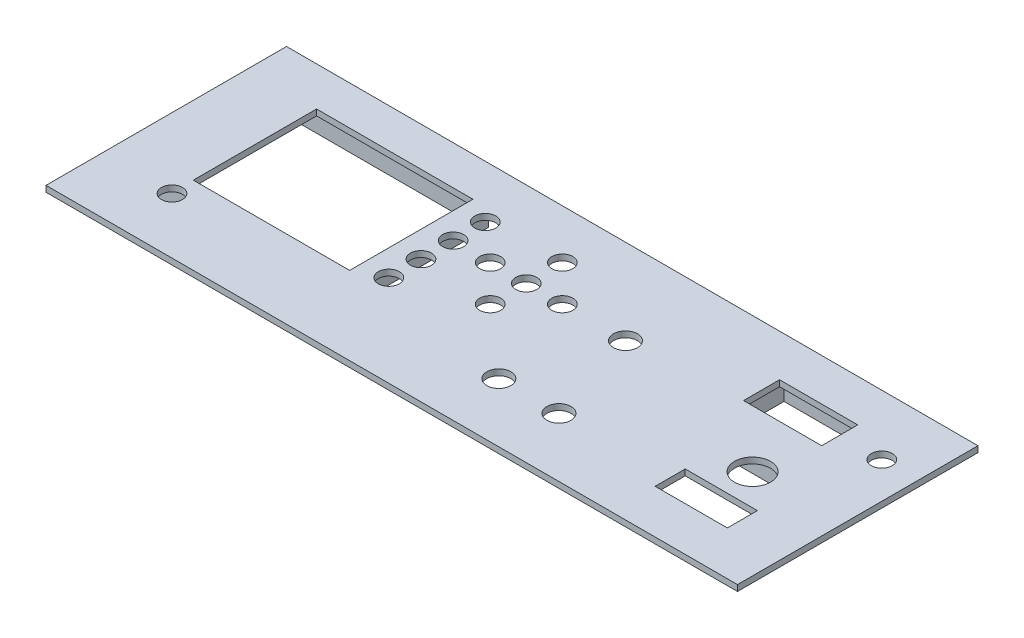
from build123d import *

# Parameters (mm, degrees)
SKETCH_1_W      = 230
SKETCH_1_H      = 80
SKETCH_1_R      = 3.5
SKETCH_1_R_2    = 4
SKETCH_1_R_3    = 6
SKETCH_1_W_2    = 52
SKETCH_1_H_2    = 41
SKETCH_1_W_3    = 26
SKETCH_1_H_3    = 12
SKETCH_1_W_4    = 24
SKETCH_1_H_4    = 10
EXTRUDE_1_DEPTH = 2
SKETCH_3_W      = 66.2
SKETCH_3_H      = 46.5
SKETCH_3_W_2    = 63.2
SKETCH_3_H_2    = 43.5
SKETCH_3_W_3    = 31
SKETCH_3_H_3    = 27.5
SKETCH_3_W_4    = 28
SKETCH_3_H_4    = 24.5
EXTRUDE_2_DEPTH = 6


with BuildPart() as part:
    # 草图1 → 凸台-拉伸1 (new body)
    with BuildSketch(Plane(origin=(0, 0, 0), x_dir=(1, 0, 0), z_dir=(0, 1, 0))):
        with Locations((23.568232821, 7.271766922)):
            Rectangle(SKETCH_1_W, SKETCH_1_H)
        with Locations(Location((-68.131767179, -14.128233078, 0), (0, 0, 270))):
            Circle(SKETCH_1_R, mode=Mode.SUBTRACT)
        with Locations(Location((-7.811767179, 29.771766922, 0), (0, 0, 270))):
            Circle(SKETCH_1_R, mode=Mode.SUBTRACT)
        with Locations(Location((-7.811767179, 19.071766922, 0), (0, 0, 270))):
            Circle(SKETCH_1_R, mode=Mode.SUBTRACT)
        with Locations(Location((-7.811767179, 8.371766922, 0), (0, 0, 270))):
            Circle(SKETCH_1_R, mode=Mode.SUBTRACT)
        with Locations(Location((-7.811767179, -2.328233078, 0), (0, 0, 270))):
            Circle(SKETCH_1_R, mode=Mode.SUBTRACT)
        with Locations(Location((16.688232821, 30.896203348, 0), (0, 0, 270))):
            Circle(SKETCH_1_R, mode=Mode.SUBTRACT)
        with Locations(Location((16.688232821, 18.896203348, 0), (0, 0, 270))):
            Circle(SKETCH_1_R, mode=Mode.SUBTRACT)
        with Locations(Location((16.688232821, 6.896203348, 0), (0, 0, 270))):
            Circle(SKETCH_1_R, mode=Mode.SUBTRACT)
        with Locations(Location((4.688232821, 18.896203348, 0), (0, 0, 270))):
            Circle(SKETCH_1_R, mode=Mode.SUBTRACT)
        with Locations(Location((28.688232821, 18.896203348, 0), (0, 0, 270))):
            Circle(SKETCH_1_R, mode=Mode.SUBTRACT)
        with Locations(Location((49.688232821, 18.896203348, 0), (0, 0, 270))):
            Circle(SKETCH_1_R_2, mode=Mode.SUBTRACT)
        with Locations(Location((59.568232821, -13.103233078, 0), (0, 0, 270))):
            Circle(SKETCH_1_R_2, mode=Mode.SUBTRACT)
        with Locations(Location((39.568232821, -13.103233078, 0), (0, 0, 270))):
            Circle(SKETCH_1_R_2, mode=Mode.SUBTRACT)
        with Locations(Location((126.568232821, 27.271766922, 0), (0, 0, 270))):
            Circle(SKETCH_1_R, mode=Mode.SUBTRACT)
        with Locations(Location((108.568232821, 2.271766922, 0), (0, 0, 270))):
            Circle(SKETCH_1_R_3, mode=Mode.SUBTRACT)
        with Locations((-42.431767179, 13.771766922)):
            Rectangle(SKETCH_1_W_2, SKETCH_1_H_2, mode=Mode.SUBTRACT)
        with Locations((99.568232821, 27.271766922)):
            Rectangle(SKETCH_1_W_3, SKETCH_1_H_3, mode=Mode.SUBTRACT)
        with Locations((108.568232821, -13.103233078)):
            Rectangle(SKETCH_1_W_4, SKETCH_1_H_4, mode=Mode.SUBTRACT)
    extrude(amount=EXTRUDE_1_DEPTH)

    # 草图3 → 凸台-拉伸2 (add)
    # profile 1 of 2: a face of its own
    with BuildSketch(Plane.XZ):
        with Locations((-46.831767179, -13.521766922)):
            Rectangle(SKETCH_3_W, SKETCH_3_H)
        with Locations((-46.831767179, -13.521766922)):
            Rectangle(SKETCH_3_W_2, SKETCH_3_H_2, mode=Mode.SUBTRACT)
    # profile 2 of 2: a face of its own
    with BuildSketch(Plane.XZ):
        with Locations((99.568232821, -23.521766922)):
            Rectangle(SKETCH_3_W_3, SKETCH_3_H_3)
        with Locations((99.568232821, -23.521766922)):
            Rectangle(SKETCH_3_W_4, SKETCH_3_H_4, mode=Mode.SUBTRACT)
    extrude(amount=EXTRUDE_2_DEPTH)


solid = part.part
